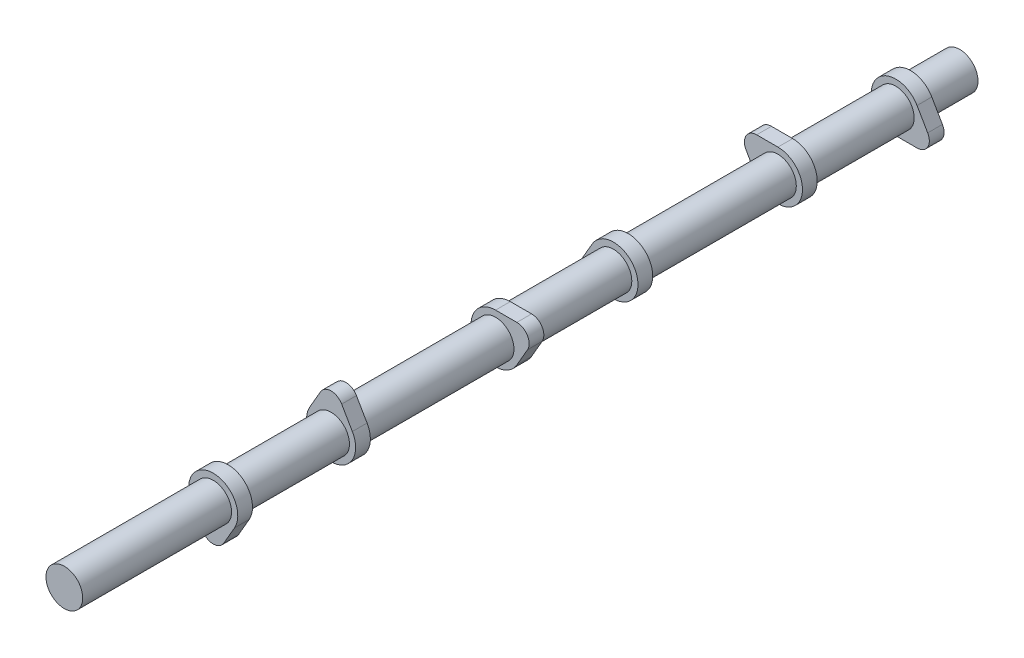
from build123d import *

# Parameters (mm, degrees)
BOSS_EXTRUDE1_DEPTH   = 7.62
BODY_MOVE_COPY2_ANGLE = 180
BOSS_EXTRUDE2_START   = -25.4
SKETCH3_R             = 9.5
BOSS_EXTRUDE2_DEPTH   = 146.05
LPATTERN1_COUNT       = 3
LPATTERN1_PITCH       = 146.05
BODY_MOVE_COPY3_ANGLE = 120
BODY_MOVE_COPY4_ANGLE = 120
SKETCH4_R             = 9.5
BOSS_EXTRUDE3_DEPTH   = 24.94


with BuildPart() as part:
    # Sketch1 → Boss-Extrude1 (new body)
    with BuildSketch(Plane.XY):
        with BuildLine():
            Line((-5.499261314, 15.875), (-10.998522628, 6.35))
            ThreePointArc((-10.998522628, 6.35), (0, -12.7), (10.998522628, 6.35))
            Line((10.998522628, 6.35), (5.499261314, 15.875))
            ThreePointArc((5.499261314, 15.875), (0, 19.05), (-5.499261314, 15.875))
        make_face()
    extrude(amount=BOSS_EXTRUDE1_DEPTH)


with BuildPart() as body_2:
    # Body-Move/Copy1: copy of part
    add(part.part.moved(Location((0, 0, 60.96))))


with BuildPart() as body_2_1:
    # Body-Move/Copy2: moved
    add(body_2.part.rotate(Axis((0, 0, 0), (0, 0, 1)), BODY_MOVE_COPY2_ANGLE))


with BuildPart() as part_1:
    add(part.part)

    add(body_2_1.part)  # Boss-Extrude2 merges body 2
    # Sketch3 → Boss-Extrude2 (add)
    with BuildSketch(Plane.XY.offset(BOSS_EXTRUDE2_START)):
        Circle(SKETCH3_R)
    extrude(amount=BOSS_EXTRUDE2_DEPTH)


with BuildPart() as lpattern1_1:
    # LPattern1: pattern copy
    add(part_1.part.moved(Location(Vector(0, 0, -1) * (1 * LPATTERN1_PITCH))))


with BuildPart() as lpattern1_2:
    # LPattern1: pattern copy
    add(part_1.part.moved(Location(Vector(0, 0, -1) * (2 * LPATTERN1_PITCH))))


with BuildPart() as lpattern1_1_1:
    # Body-Move/Copy3: moved
    add(lpattern1_1.part.rotate(Axis((0, 0, 0), (0, 0, 1)), BODY_MOVE_COPY3_ANGLE))


with BuildPart() as lpattern1_2_1:
    # Body-Move/Copy4: moved
    add(lpattern1_2.part.rotate(Axis((0, 0, 0), (0, 0, -1)), BODY_MOVE_COPY4_ANGLE))


with BuildPart() as part_2:
    add(part_1.part)

    # Sketch4 → Boss-Extrude3 (add)
    with BuildSketch(Plane.XY.offset(120.65)):
        Circle(SKETCH4_R)
    extrude(amount=BOSS_EXTRUDE3_DEPTH)

    # Combine1: union LPattern1_1, LPattern1_2
    add(lpattern1_1_1.part)
    add(lpattern1_2_1.part)


solid = part_2.part
